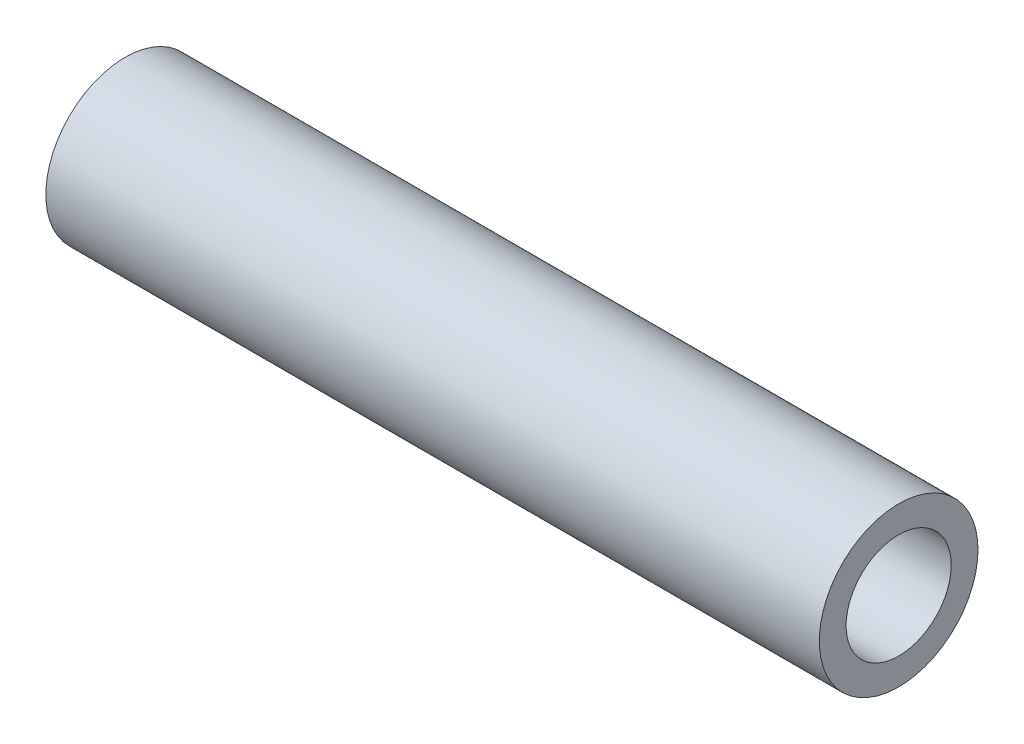
from build123d import *

# Parameters (mm, degrees)
SKETCH_1_R      = 4
SKETCH_1_R_2    = 2.65
EXTRUDE_1_DEPTH = 39


with BuildPart() as part:
    # 草图1 → 凸台-拉伸1 (new body)
    with BuildSketch(Plane(origin=(0, 0, 0), x_dir=(0, 0, -1), z_dir=(1, 0, 0))):
        Circle(SKETCH_1_R)
        Circle(SKETCH_1_R_2, mode=Mode.SUBTRACT)
    extrude(amount=EXTRUDE_1_DEPTH)


solid = part.part
